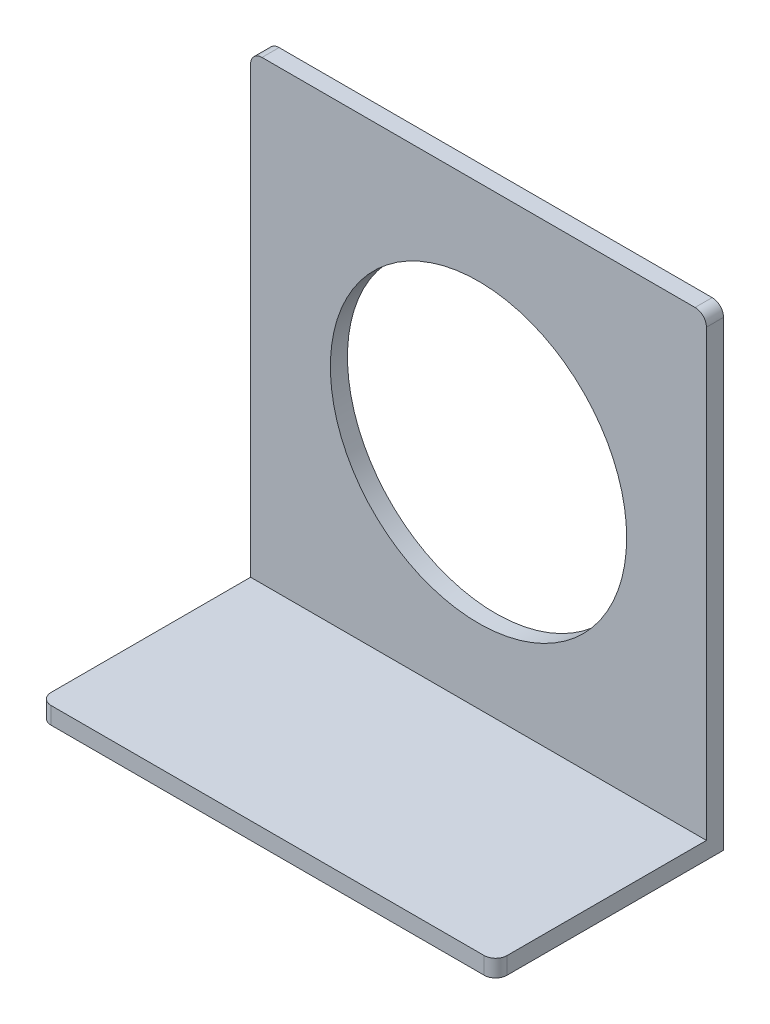
from build123d import *

# Parameters (mm, degrees)
SKETCH1_W           = 40
SKETCH1_H           = 41.5
BOSS_EXTRUDE1_DEPTH = 1.5
SKETCH2_W           = 40
SKETCH2_H           = 1.5
BOSS_EXTRUDE2_DEPTH = 18.5
FILLET1_R           = 1
FILLET2_R           = 1
SKETCH3_R           = 13
CUT_EXTRUDE1_DEPTH  = 1.5


with BuildPart() as part:
    # Sketch1 → Boss-Extrude1 (new body)
    with BuildSketch(Plane.XY):
        with Locations((20, 20.75)):
            Rectangle(SKETCH1_W, SKETCH1_H)
    extrude(amount=BOSS_EXTRUDE1_DEPTH)

    # Sketch2 → Boss-Extrude2 (add)
    with BuildSketch(Plane.XY.offset(1.5)):
        with Locations((20, 0.75)):
            Rectangle(SKETCH2_W, SKETCH2_H)
    extrude(amount=BOSS_EXTRUDE2_DEPTH)

    # Fillet1
    fillet1_edges = [part.edges().sort_by_distance(p)[0] for p in [
        (0, 41.5, 0.75),
    ]]
    fillet(fillet1_edges, radius=FILLET1_R)

    # Fillet2
    fillet2_edges = [part.edges().sort_by_distance(p)[0] for p in [
        (0, 0.75, 20),
        (40, 0.75, 20),
        (40, 41.5, 0.75),
    ]]
    fillet(fillet2_edges, radius=FILLET2_R)

    # Sketch3 → Cut-Extrude1 (cut)
    with BuildSketch(Plane.XY.offset(1.5)):
        with Locations((20, 21)):
            Circle(SKETCH3_R)
    extrude(amount=-CUT_EXTRUDE1_DEPTH, mode=Mode.SUBTRACT)


solid = part.part
